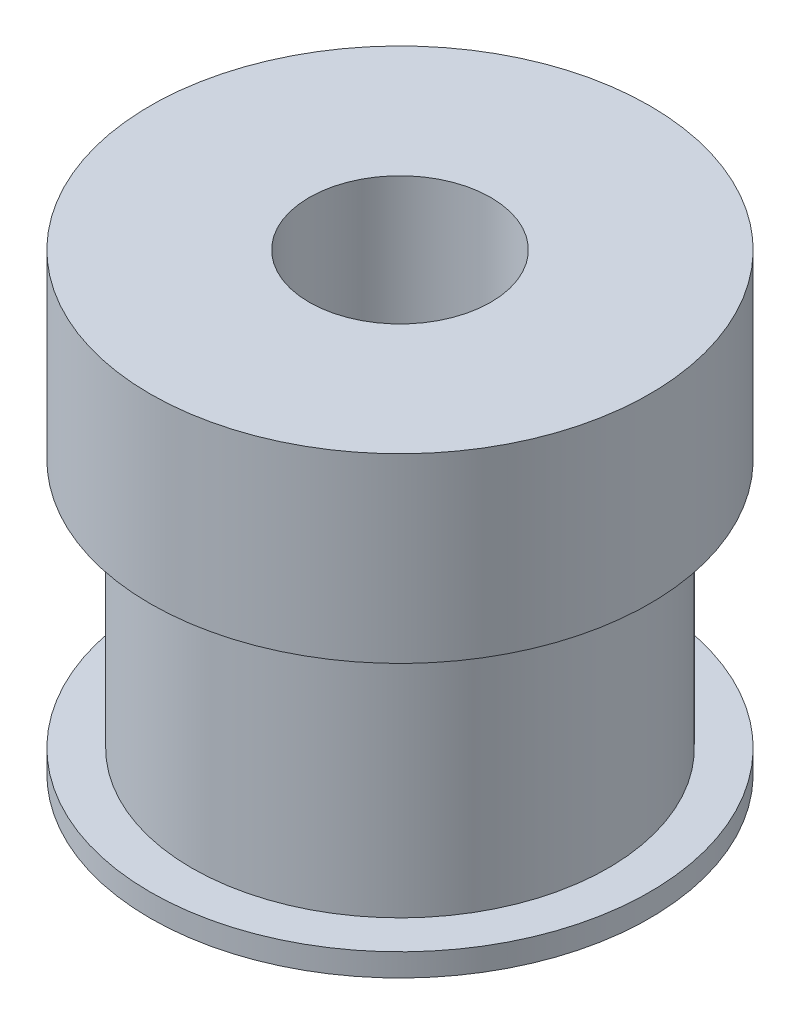
from build123d import *

# Parameters (mm, degrees)
SKETCH_1_R          = 11
EXTRUDE_1_DEPTH     = 1
SKETCH_2_R          = 9.17
EXTRUDE_2_DEPTH     = 11
SKETCH_3_R          = 11
EXTRUDE_3_DEPTH     = 8
SKETCH_4_R          = 4
CUT_EXTRUDE_1_DEPTH = 26.337718919


with BuildPart() as part:
    # Эскиз1 → Бобышка-Вытянуть1 (new body)
    with BuildSketch(Plane(origin=(0, 0, 0), x_dir=(1, 0, 0), z_dir=(0, 1, 0))):
        with Locations(Location((0, 0, 0), (0, 0, 270))):
            Circle(SKETCH_1_R)
    extrude(amount=EXTRUDE_1_DEPTH)

    # Эскиз2 → Бобышка-Вытянуть2 (add)
    with BuildSketch(Plane(origin=(0, 1, 0), x_dir=(1, 0, 0), z_dir=(0, 1, 0))):
        with Locations(Location((0, 0, 0), (0, 0, 270))):
            Circle(SKETCH_2_R)
    extrude(amount=EXTRUDE_2_DEPTH)

    # Эскиз3 → Бобышка-Вытянуть3 (add)
    with BuildSketch(Plane(origin=(0, 12, 0), x_dir=(1, 0, 0), z_dir=(0, 1, 0))):
        with Locations(Location((0, 0, 0), (0, 0, 270))):
            Circle(SKETCH_3_R)
    extrude(amount=EXTRUDE_3_DEPTH)

    # Эскиз4 → Вырез-Вытянуть1 (cut, through all)
    with BuildSketch(Plane(origin=(0, 20, 0), x_dir=(1, 0, 0), z_dir=(0, 1, 0))):
        with Locations(Location((0, 0, 0), (0, 0, 270))):
            Circle(SKETCH_4_R)
    extrude(amount=-CUT_EXTRUDE_1_DEPTH, mode=Mode.SUBTRACT)


solid = part.part
